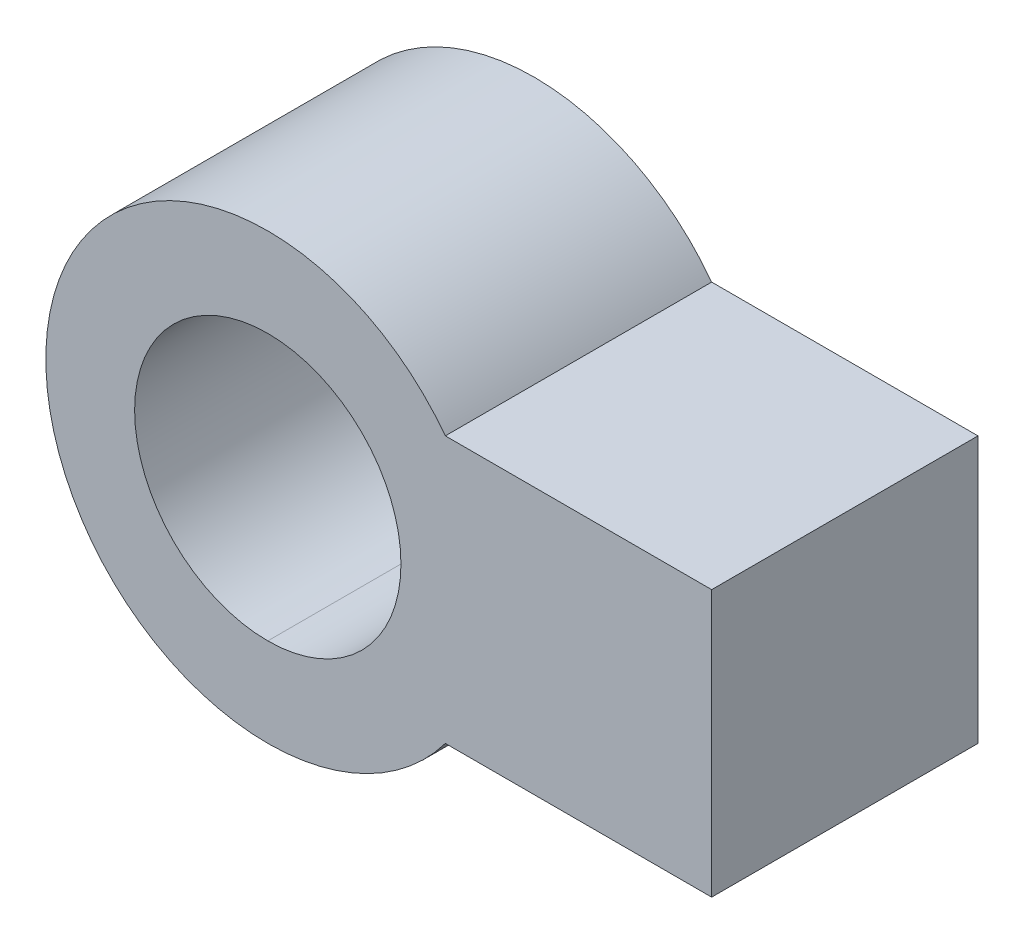
from build123d import *

# Parameters (mm, degrees)
SKETCH1_R           = 3
BOSS_EXTRUDE1_DEPTH = 6


with BuildPart() as part:
    # Sketch1 → Boss-Extrude1 (new body)
    with BuildSketch(Plane.XY):
        with BuildLine():
            ThreePointArc((4, 3), (-5, 0), (4, -3))
            Line((4, -3), (10, -3))
            Line((10, -3), (10, 3))
            Line((10, 3), (4, 3))
        make_face()
        Circle(SKETCH1_R, mode=Mode.SUBTRACT)
    extrude(amount=BOSS_EXTRUDE1_DEPTH)


solid = part.part
